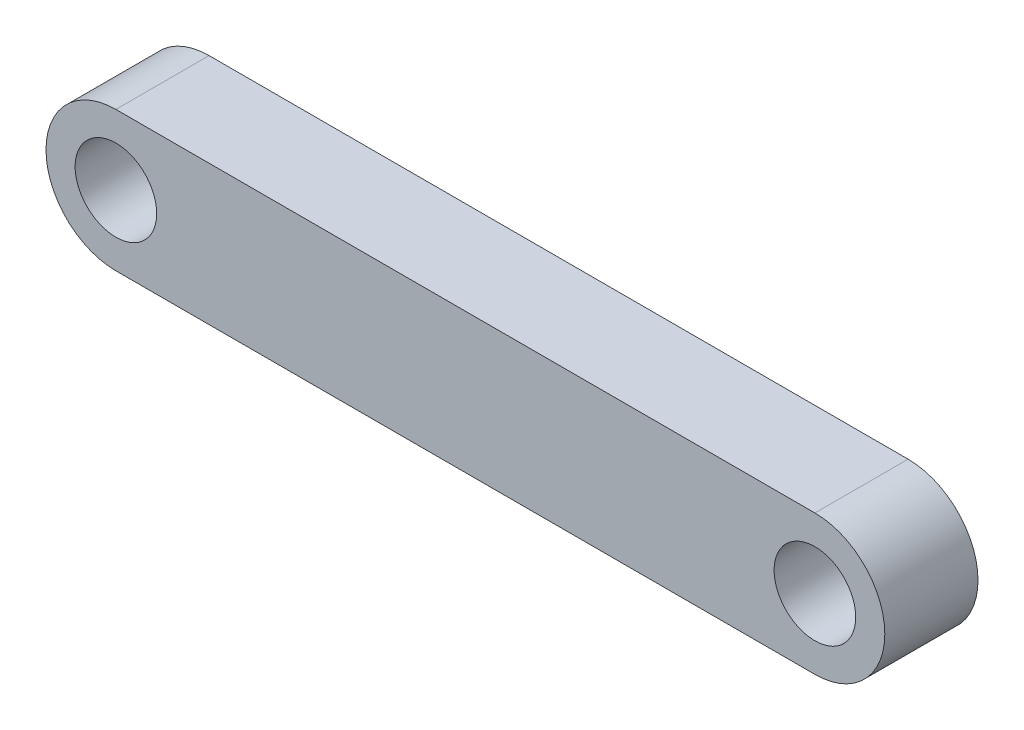
from build123d import *

# Parameters (mm, degrees)
SKETCH_1_R      = 1.75
EXTRUDE_1_DEPTH = 4


with BuildPart() as part:
    # 草图1 → 凸台-拉伸1 (new body)
    with BuildSketch(Plane.XY):
        with BuildLine():
            Line((0, -3), (30, -3))
            ThreePointArc((30, -3), (33, 0), (30, 3))
            Line((30, 3), (0, 3))
            ThreePointArc((0, 3), (-3, 0), (0, -3))
        make_face()
        Circle(SKETCH_1_R, mode=Mode.SUBTRACT)
        with Locations((30, 0)):
            Circle(SKETCH_1_R, mode=Mode.SUBTRACT)
    extrude(amount=EXTRUDE_1_DEPTH)


solid = part.part
